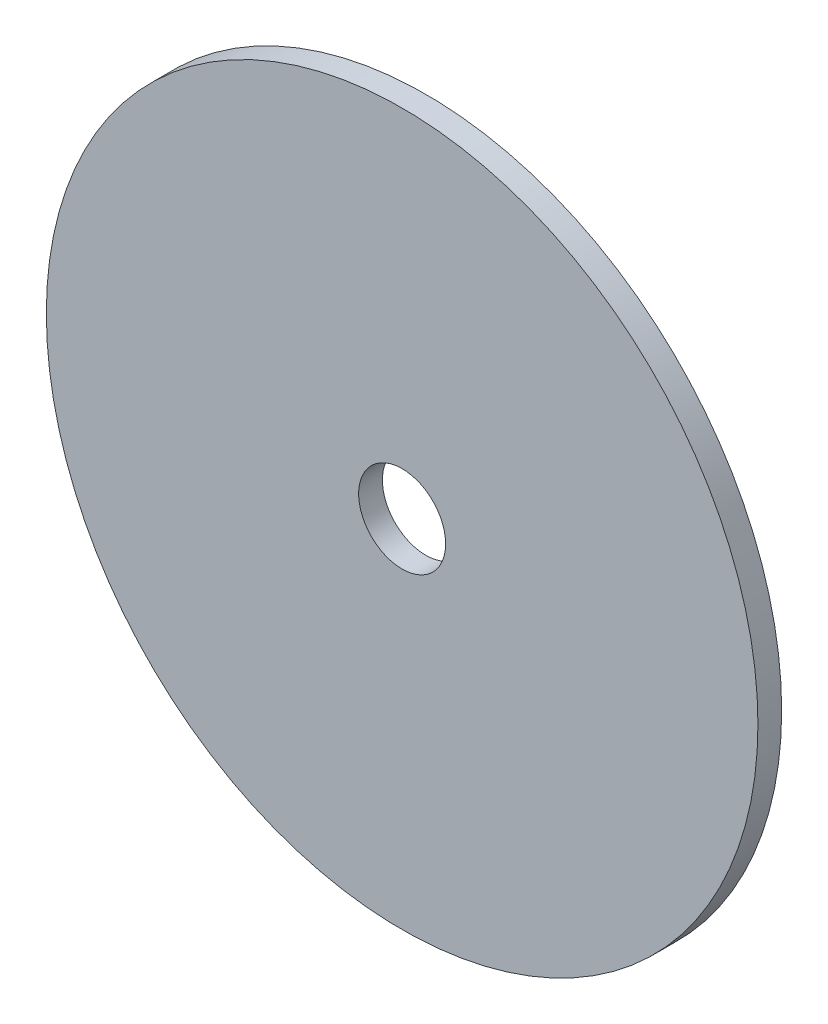
from build123d import *

# Parameters (mm, degrees)
SKETCH_1_R      = 22.5
SKETCH_1_R_2    = 2.75
EXTRUDE_1_DEPTH = 1.5


with BuildPart() as part:
    # Эскиз1 → Вытянуть1 (new body)
    with BuildSketch(Plane.XY):
        Circle(SKETCH_1_R)
        Circle(SKETCH_1_R_2, mode=Mode.SUBTRACT)
    extrude(amount=EXTRUDE_1_DEPTH)


solid = part.part
